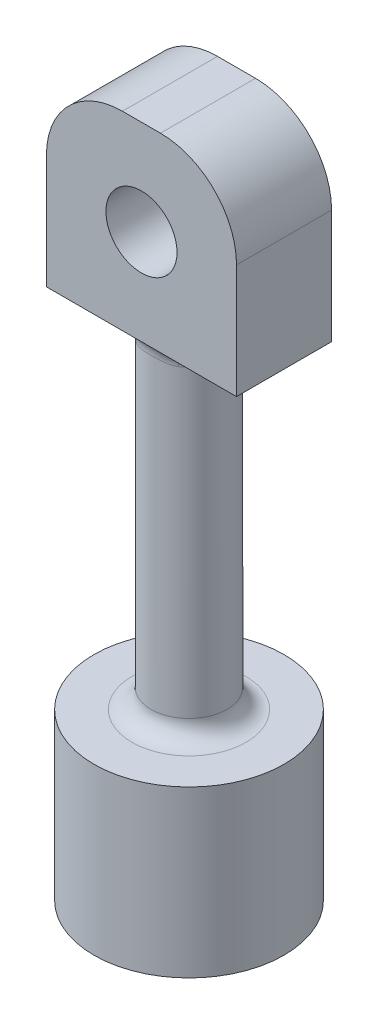
from build123d import *

# Parameters (mm, degrees)
SKETCH1_R           = 0.25
BOSS_EXTRUDE1_DEPTH = 0.435
SKETCH2_R           = 0.1
BOSS_EXTRUDE2_DEPTH = 0.9
SKETCH3_W           = 0.5
SKETCH3_H           = 0.25
BOSS_EXTRUDE3_DEPTH = 0.5
FILLET1_R           = 0.2
FILLET2_R           = 0.2
SKETCH5_R           = 0.0935
CUT_EXTRUDE1_DEPTH  = 0.25
FILLET3_R           = 0.05
FILLET4_R           = 0.05


with BuildPart() as part:
    # Sketch1 → Boss-Extrude1 (new body)
    with BuildSketch(Plane(origin=(0, 0, 0), x_dir=(1, 0, 0), z_dir=(0, 1, 0))):
        with Locations(Location((0, 0, 0), (0, 0, 270))):
            Circle(SKETCH1_R)
    extrude(amount=BOSS_EXTRUDE1_DEPTH)

    # Sketch2 → Boss-Extrude2 (add)
    with BuildSketch(Plane(origin=(0, 0.435, 0), x_dir=(1, 0, 0), z_dir=(0, 1, 0))):
        with Locations(Location((0, 0, 0), (0, 0, 270))):
            Circle(SKETCH2_R)
    extrude(amount=BOSS_EXTRUDE2_DEPTH)

    # Sketch3 → Boss-Extrude3 (add)
    with BuildSketch(Plane(origin=(0, 1.335, 0), x_dir=(1, 0, 0), z_dir=(0, 1, 0))):
        Rectangle(SKETCH3_W, SKETCH3_H)
    extrude(amount=BOSS_EXTRUDE3_DEPTH)

    # Fillet1
    fillet1_edges = [part.edges().sort_by_distance(p)[0] for p in [
        (0.25, 1.835, 0),
    ]]
    fillet(fillet1_edges, radius=FILLET1_R)

    # Fillet2
    fillet2_edges = [part.edges().sort_by_distance(p)[0] for p in [
        (-0.25, 1.835, 0),
    ]]
    fillet(fillet2_edges, radius=FILLET2_R)

    # Sketch5 → Cut-Extrude1 (cut)
    with BuildSketch(Plane.XY.offset(0.125)):
        with Locations((0, 1.585)):
            Circle(SKETCH5_R)
    extrude(amount=-CUT_EXTRUDE1_DEPTH, mode=Mode.SUBTRACT)

    # Fillet3
    fillet3_edges = [part.edges().sort_by_distance(p)[0] for p in [
        (0, 1.335, -0.1),
    ]]
    fillet(fillet3_edges, radius=FILLET3_R)

    # Fillet4
    fillet4_edges = [part.edges().sort_by_distance(p)[0] for p in [
        (0, 0.435, -0.1),
    ]]
    fillet(fillet4_edges, radius=FILLET4_R)


solid = part.part
